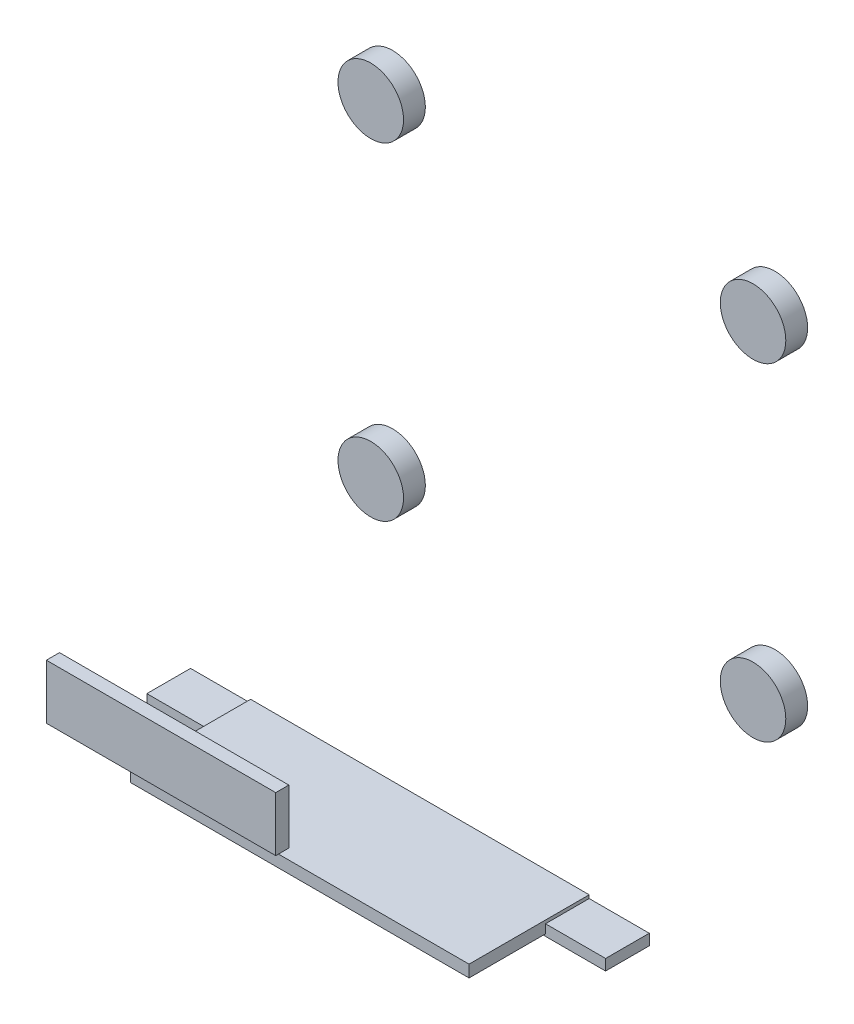
from build123d import *

# Parameters (mm, degrees)
FRONT_START                                    = 26
SKETCH_1_W                                     = 62
SKETCH_1_H                                     = 2.2
FRONT_FACE_TRIM_AROUND_HC_SR04_EYE_WINDO_DEPTH = 22
TOP_START                                      = 71
SKETCH_2_W                                     = 42
SKETCH_2_H                                     = 10
TOP_TRANSLUCENT_STATUS_LIGHT_STRIP_DEPTH       = 2.4
LEFT_START                                     = 26
SKETCH_3_W                                     = 12
SKETCH_3_H                                     = 2
LEFT_CHEEK_DECORATIVE_INSERT_DEPTH             = 8
RIGHT_START                                    = 26
SKETCH_4_W                                     = 12
SKETCH_4_H                                     = 2
RIGHT_CHEEK_DECORATIVE_INSERT_DEPTH            = 8
RUBBER_START                                   = -4
SKETCH_5_R                                     = 6
RUBBER_FOOT_1_DEPTH                            = 4
SKETCH_6_R                                     = 6
RUBBER_FOOT_2_DEPTH                            = 4
SKETCH_7_R                                     = 6
RUBBER_FOOT_3_DEPTH                            = 4
SKETCH_8_R                                     = 6
RUBBER_FOOT_4_DEPTH                            = 4


with BuildPart() as part:
    # 草图1 → front face trim around HC-SR04 eye window (new body)
    with BuildSketch(Plane.XY.offset(FRONT_START)):
        with Locations((0, -51)):
            Rectangle(SKETCH_1_W, SKETCH_1_H)
    extrude(amount=FRONT_FACE_TRIM_AROUND_HC_SR04_EYE_WINDO_DEPTH)


with BuildPart() as body_2:
    # 草图2 → top translucent status light strip (new body)
    with BuildSketch(Plane.XY.offset(TOP_START)):
        with Locations((0, -20)):
            Rectangle(SKETCH_2_W, SKETCH_2_H)
    extrude(amount=TOP_TRANSLUCENT_STATUS_LIGHT_STRIP_DEPTH)


with BuildPart() as body_3:
    # 草图3 → left cheek decorative insert (new body)
    with BuildSketch(Plane.XY.offset(LEFT_START)):
        with Locations((-36, -51.5)):
            Rectangle(SKETCH_3_W, SKETCH_3_H)
    extrude(amount=LEFT_CHEEK_DECORATIVE_INSERT_DEPTH)


with BuildPart() as body_4:
    # 草图4 → right cheek decorative insert (new body)
    with BuildSketch(Plane.XY.offset(RIGHT_START)):
        with Locations((36, -51.5)):
            Rectangle(SKETCH_4_W, SKETCH_4_H)
    extrude(amount=RIGHT_CHEEK_DECORATIVE_INSERT_DEPTH)


with BuildPart() as body_5:
    # 草图5 → rubber foot 1 (new body)
    with BuildSketch(Plane.XY.offset(RUBBER_START)):
        with Locations((-35, -30)):
            Circle(SKETCH_5_R)
    extrude(amount=RUBBER_FOOT_1_DEPTH)


with BuildPart() as body_6:
    # 草图6 → rubber foot 2 (new body)
    with BuildSketch(Plane.XY.offset(RUBBER_START)):
        with Locations((35, -30)):
            Circle(SKETCH_6_R)
    extrude(amount=RUBBER_FOOT_2_DEPTH)


with BuildPart() as body_7:
    # 草图7 → rubber foot 3 (new body)
    with BuildSketch(Plane.XY.offset(RUBBER_START)):
        with Locations((-35, 30)):
            Circle(SKETCH_7_R)
    extrude(amount=RUBBER_FOOT_3_DEPTH)


with BuildPart() as body_8:
    # 草图8 → rubber foot 4 (new body)
    with BuildSketch(Plane.XY.offset(RUBBER_START)):
        with Locations((35, 30)):
            Circle(SKETCH_8_R)
    extrude(amount=RUBBER_FOOT_4_DEPTH)


solid = Compound([part.part, body_2.part, body_3.part, body_4.part, body_5.part, body_6.part, body_7.part, body_8.part])
